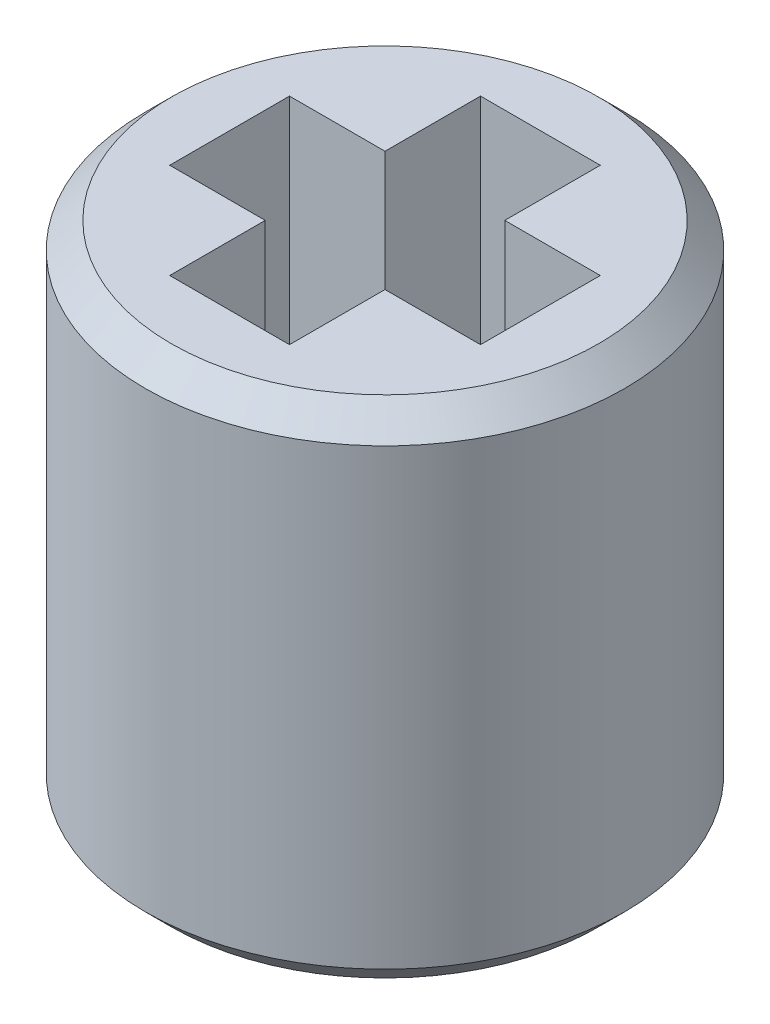
from build123d import *

# Parameters (mm, degrees)
SKETCH1_R           = 3.7
BOSS_EXTRUDE1_DEPTH = 3.9
CUT_EXTRUDE1_DEPTH  = 10.392550239
CHAMFER1_SIZE       = 0.4


with BuildPart() as part:
    # Sketch1 → Boss-Extrude1 (new, symmetric)
    with BuildSketch(Plane(origin=(0, 0, 0), x_dir=(1, 0, 0), z_dir=(0, 1, 0))):
        with Locations(Location((0, 0, 0), (0, 0, 270))):
            Circle(SKETCH1_R)
    extrude(amount=BOSS_EXTRUDE1_DEPTH, both=True)

    # Sketch2 → Cut-Extrude1 (cut, through all)
    with BuildSketch(Plane(origin=(0, 3.9, 0), x_dir=(1, 0, 0), z_dir=(0, 1, 0))):
        Polygon((0.925, 0.925), (2.4, 0.925), (2.4, -0.925), (0.925, -0.925), (0.925, -2.4), (-0.925, -2.4), (-0.925, -0.925), (-2.4, -0.925), (-2.4, 0.925), (-0.925, 0.925), (-0.925, 2.4), (0.925, 2.4), align=None)
    extrude(amount=-CUT_EXTRUDE1_DEPTH, mode=Mode.SUBTRACT)

    # Chamfer1
    chamfer1_edges = [part.edges().sort_by_distance(p)[0] for p in [
        (0, -3.9, -3.7),
        (0, 3.9, -3.7),
    ]]
    chamfer(chamfer1_edges, length=CHAMFER1_SIZE)


solid = part.part
